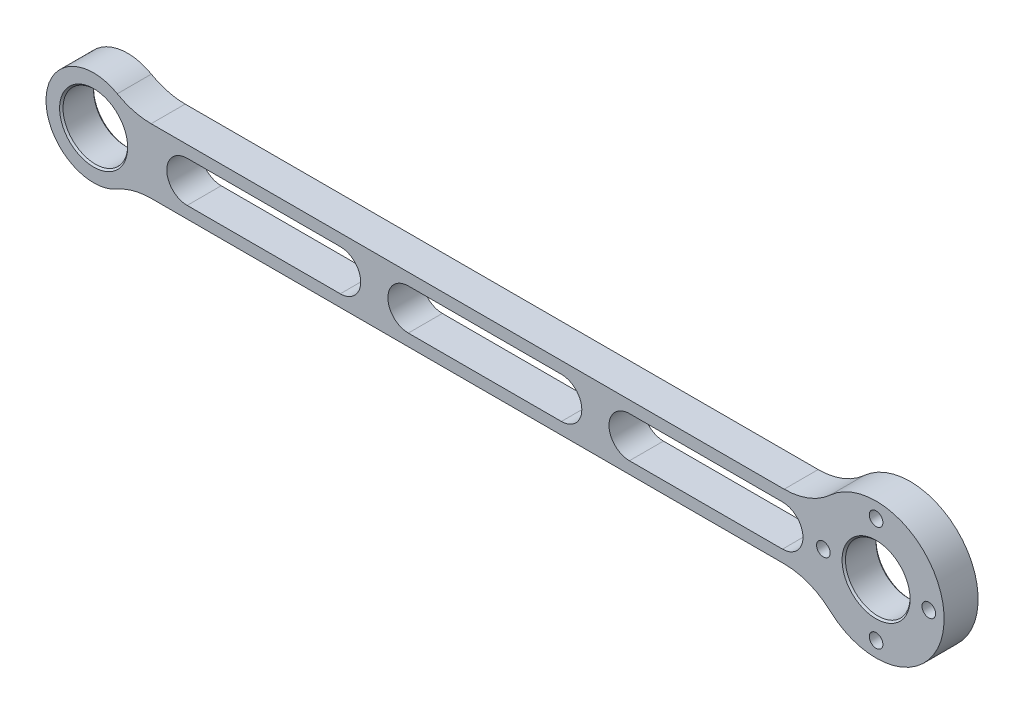
from build123d import *

# Parameters (mm, degrees)
SKETCH_1_R               = 9.5
EXTRUDE_2_DEPTH          = 10
CHAMFER_1_SIZE           = 0.5
CUT_EXTRUDE_1_DEPTH      = 10
SKETCH_3_R               = 2
CUT_EXTRUDE_2_DEPTH      = 10
CHAMFER_2_SIZE           = 0.5
SKETCH_5_R               = 2
CUT_EXTRUDE_3_DEPTH      = 10
CHAMFER_3_SIZE           = 0.5
SKETCH_9_R               = 2
EXTRUDE_3_DEPTH          = 10
CUT_EXTRUDE_6_DEPTH      = 10
PATTERN_CIRCULAR_2_COUNT = 4


with BuildPart() as part:
    # 草图1 → 凸台-拉伸2 (new body)
    with BuildSketch(Plane.XY):
        with BuildLine():
            Line((20.821645942, -9.5), (202.986114682, -9.5))
            ThreePointArc((202.986114682, -9.5), (210.231803055, -10.858648118), (216.493057341, -14.75))
            ThreePointArc((216.493057341, -14.75), (250, 0), (216.493057341, 14.75))
            ThreePointArc((216.493057341, 14.75), (210.231803055, 10.858648118), (202.986114682, 9.5))
            Line((202.986114682, 9.5), (21.63860854, 9.5))
            Line((21.63860854, 9.5), (16.904141504, 9.5))
            ThreePointArc((16.904141504, 9.5), (11.75918395, 10.173090993), (6.960528855, 12.147058824))
            ThreePointArc((6.960528855, 12.147058824), (3.490452231, 13.557903349), (-0.229510749, 13.998118617))
            ThreePointArc((-0.229510749, 13.998118617), (-13.878745314, -1.838594167), (3.423256182, -13.575025492))
            ThreePointArc((3.423256182, -13.575025492), (5.240755683, -12.982083033), (6.960528855, -12.147058824))
            ThreePointArc((6.960528855, -12.147058824), (11.75918395, -10.173090993), (16.904141504, -9.5))
            Line((16.904141504, -9.5), (20.821645942, -9.5))
        make_face()
        Circle(SKETCH_1_R, mode=Mode.SUBTRACT)
        with Locations((230, 0)):
            Circle(SKETCH_1_R, mode=Mode.SUBTRACT)
    extrude(amount=EXTRUDE_2_DEPTH)

    # 倒角1
    chamfer_1_edges = [part.edges().sort_by_distance(p)[0] for p in [
        (-9.5, 0, 10),
        (-9.5, 0, 0),
    ]]
    chamfer(chamfer_1_edges, length=CHAMFER_1_SIZE)

    # 草图2 → 切除-拉伸1 (cut)
    with BuildSketch(Plane.XY.offset(10)):
        with BuildLine():
            Line((92.5, -6), (137.5, -6))
            ThreePointArc((137.5, -6), (143.5, 0), (137.5, 6))
            Line((137.5, 6), (92.5, 6))
            ThreePointArc((92.5, 6), (86.5, 0), (92.5, -6))
        make_face()
        with BuildLine():
            Line((157.5, -6), (202.5, -6))
            ThreePointArc((202.5, -6), (208.5, 0), (202.5, 6))
            Line((202.5, 6), (157.5, 6))
            ThreePointArc((157.5, 6), (151.5, 0), (157.5, -6))
        make_face()
        with BuildLine():
            Line((27.5, -6), (72.5, -6))
            ThreePointArc((72.5, -6), (78.5, 0), (72.5, 6))
            Line((72.5, 6), (27.5, 6))
            ThreePointArc((27.5, 6), (21.5, 0), (27.5, -6))
        make_face()
    extrude(amount=-CUT_EXTRUDE_1_DEPTH, mode=Mode.SUBTRACT)

    # 草图3 → 切除-拉伸2 (cut)
    with BuildSketch(Plane.XY.offset(10)):
        with Locations((222.5, 12.990381057)):
            Circle(SKETCH_3_R)
        with Locations((237.5, 12.990381057)):
            Circle(SKETCH_3_R)
        with Locations((245, 0)):
            Circle(SKETCH_3_R)
    extrude(amount=-CUT_EXTRUDE_2_DEPTH, mode=Mode.SUBTRACT)

    # 倒角2
    chamfer_2_edges = [part.edges().sort_by_distance(p)[0] for p in [
        (220.5, 0, 10),
    ]]
    chamfer(chamfer_2_edges, length=CHAMFER_2_SIZE)

    # 草图5 → 切除-拉伸3 (cut)
    with BuildSketch(Plane.XY.offset(10)):
        with Locations((215, 0)):
            Circle(SKETCH_5_R)
        with Locations((222.5, -12.990381057)):
            Circle(SKETCH_5_R)
        with Locations((237.5, -12.990381057)):
            Circle(SKETCH_5_R)
    extrude(amount=-CUT_EXTRUDE_3_DEPTH, mode=Mode.SUBTRACT)

    # 倒角3
    chamfer_3_edges = [part.edges().sort_by_distance(p)[0] for p in [
        (220.5, 0, 0),
    ]]
    chamfer(chamfer_3_edges, length=CHAMFER_3_SIZE)

    # 草图9 → 凸台-拉伸3 (add)
    with BuildSketch(Plane.XY.offset(10)):
        with Locations((215, 0)):
            Circle(SKETCH_9_R)
        with Locations((222.5, 12.990381057)):
            Circle(SKETCH_9_R)
        with Locations((237.5, 12.990381057)):
            Circle(SKETCH_9_R)
        with Locations((245, 0)):
            Circle(SKETCH_9_R)
        with Locations((237.5, -12.990381057)):
            Circle(SKETCH_9_R)
        with Locations((222.5, -12.990381057)):
            Circle(SKETCH_9_R)
    extrude(amount=-EXTRUDE_3_DEPTH)

    # 草图10 → 切除-拉伸6 (cut)
    with BuildSketch(Plane.XY.offset(10)):
        with BuildLine():
            ThreePointArc((214.629032258, -1.995833329), (215.959120371, -1.367833229), (216.5, 0))
            ThreePointArc((216.5, 0), (215.959120371, 1.367833229), (214.629032258, 1.995833329))
            ThreePointArc((214.629032258, 1.995833329), (212.5, 0), (214.629032258, -1.995833329))
        make_face()
    cut_extrude_6 = extrude(amount=-CUT_EXTRUDE_6_DEPTH, mode=Mode.SUBTRACT)

    # 阵列(圆周)2: 切除-拉伸6 ×4 about axis
    pattern_circular_2_axis = Axis((230, 0, 9.5), (0, 0, -1))
    for i in range(1, PATTERN_CIRCULAR_2_COUNT):
        add(cut_extrude_6.rotate(pattern_circular_2_axis, i * 360 / PATTERN_CIRCULAR_2_COUNT), mode=Mode.SUBTRACT)


solid = part.part
